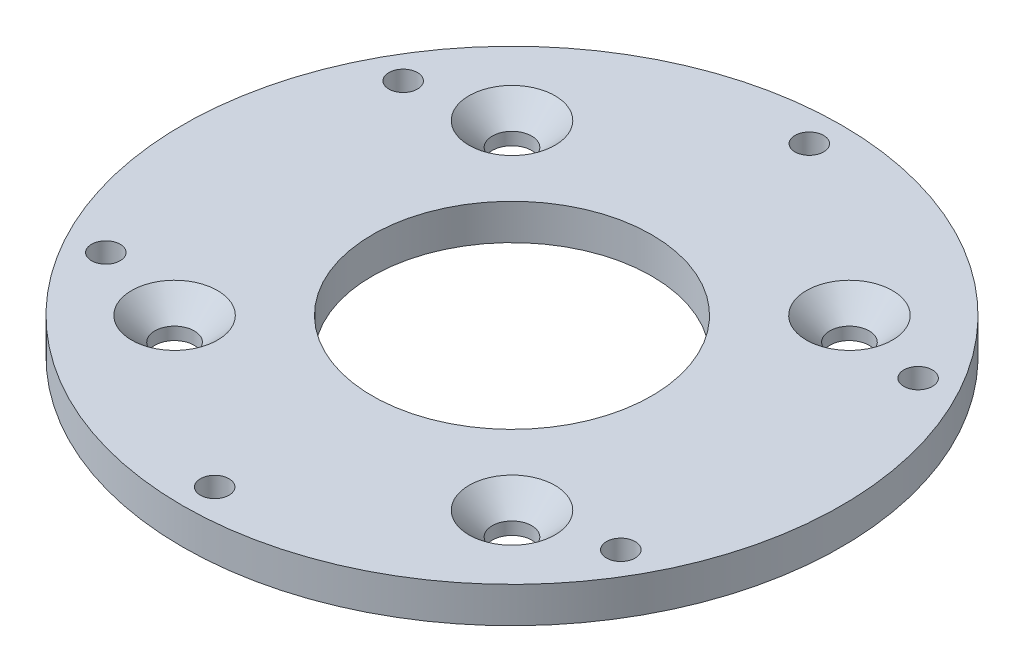
from build123d import *

# Parameters (mm, degrees)
SKETCH1_R                                    = 46
SKETCH1_R_2                                  = 2.5
BOSS_EXTRUDE1_DEPTH                          = 5
SKETCH3_R                                    = 2
CUT_EXTRUDE2_DEPTH                           = 66.245689513
SKETCH7_R                                    = 19.5
CUT_EXTRUDE3_DEPTH                           = 66.245689513
CSK_FOR_M5_SOCKET_COUNTERSUNK_HEAD_S_2_COUNT = 2
CSK_FOR_M5_SOCKET_COUNTERSUNK_HEAD_S_2_PITCH = 47.1
CSK_FOR_M5_SOCKET_COUNTERSUNK_HEAD_S_3_COUNT = 2
CSK_FOR_M5_SOCKET_COUNTERSUNK_HEAD_S_3_PITCH = 66.609458788
CSK_FOR_M5_SOCKET_COUNTERSUNK_HEAD_S_4_COUNT = 2
CSK_FOR_M5_SOCKET_COUNTERSUNK_HEAD_S_4_PITCH = 47.1


with BuildPart() as part:
    # Sketch1 → Boss-Extrude1 (new body)
    with BuildSketch(Plane(origin=(0, 0, 0), x_dir=(1, 0, 0), z_dir=(0, 1, 0))):
        Circle(SKETCH1_R)
        with Locations((-23.55, -23.55)):
            Circle(SKETCH1_R_2, mode=Mode.SUBTRACT)
        with Locations((23.55, -23.55)):
            Circle(SKETCH1_R_2, mode=Mode.SUBTRACT)
        with Locations((-23.55, 23.55)):
            Circle(SKETCH1_R_2, mode=Mode.SUBTRACT)
        with Locations((23.55, 23.55)):
            Circle(SKETCH1_R_2, mode=Mode.SUBTRACT)
    extrude(amount=BOSS_EXTRUDE1_DEPTH)

    # Sketch3 → Cut-Extrude2 (cut, through all)
    with BuildSketch(Plane.XZ):
        with Locations((0, 41.5)):
            Circle(SKETCH3_R)
        with Locations((35.940054257, 20.75)):
            Circle(SKETCH3_R)
        with Locations((35.940054257, -20.75)):
            Circle(SKETCH3_R)
        with Locations((0, -41.5)):
            Circle(SKETCH3_R)
        with Locations((-35.940054257, -20.75)):
            Circle(SKETCH3_R)
        with Locations((-35.940054257, 20.75)):
            Circle(SKETCH3_R)
    extrude(amount=-CUT_EXTRUDE2_DEPTH, mode=Mode.SUBTRACT)

    # Sketch7 → Cut-Extrude3 (cut, through all)
    with BuildSketch(Plane.XZ):
        Circle(SKETCH7_R)
    extrude(amount=-CUT_EXTRUDE3_DEPTH, mode=Mode.SUBTRACT)

    # Sketch8 → CSK for M5 socket countersunk head screw1 (revolve, cut)
    with BuildSketch(Plane(origin=(23.55, 5, -23.55), x_dir=(0, 0, 1), z_dir=(1, 0, 0))):
        Polygon((0, 0), (0, 5), (2.75, 5), (2.75, 3.25), (6, 0), align=None)
    csk_for_m5_socket_countersunk_head_screw = revolve(axis=Axis((23.55, 11.35, -23.55), (0, -1, 0)), mode=Mode.SUBTRACT)

    # CSK for M5 socket countersunk head s 2: CSK for M5 socket countersunk head screw1 ×2
    with Locations(*[(0, 0, i * CSK_FOR_M5_SOCKET_COUNTERSUNK_HEAD_S_2_PITCH) for i in range(1, CSK_FOR_M5_SOCKET_COUNTERSUNK_HEAD_S_2_COUNT)]):
        add(csk_for_m5_socket_countersunk_head_screw, mode=Mode.SUBTRACT)

    # CSK for M5 socket countersunk head s 3: CSK for M5 socket countersunk head screw1 ×2
    with Locations(*[Vector(-0.7071067811865476, 0, 0.7071067811865476) * (i * CSK_FOR_M5_SOCKET_COUNTERSUNK_HEAD_S_3_PITCH) for i in range(1, CSK_FOR_M5_SOCKET_COUNTERSUNK_HEAD_S_3_COUNT)]):
        add(csk_for_m5_socket_countersunk_head_screw, mode=Mode.SUBTRACT)

    # CSK for M5 socket countersunk head s 4: CSK for M5 socket countersunk head screw1 ×2
    with Locations(*[(-i * CSK_FOR_M5_SOCKET_COUNTERSUNK_HEAD_S_4_PITCH, 0, 0) for i in range(1, CSK_FOR_M5_SOCKET_COUNTERSUNK_HEAD_S_4_COUNT)]):
        add(csk_for_m5_socket_countersunk_head_screw, mode=Mode.SUBTRACT)


solid = part.part
